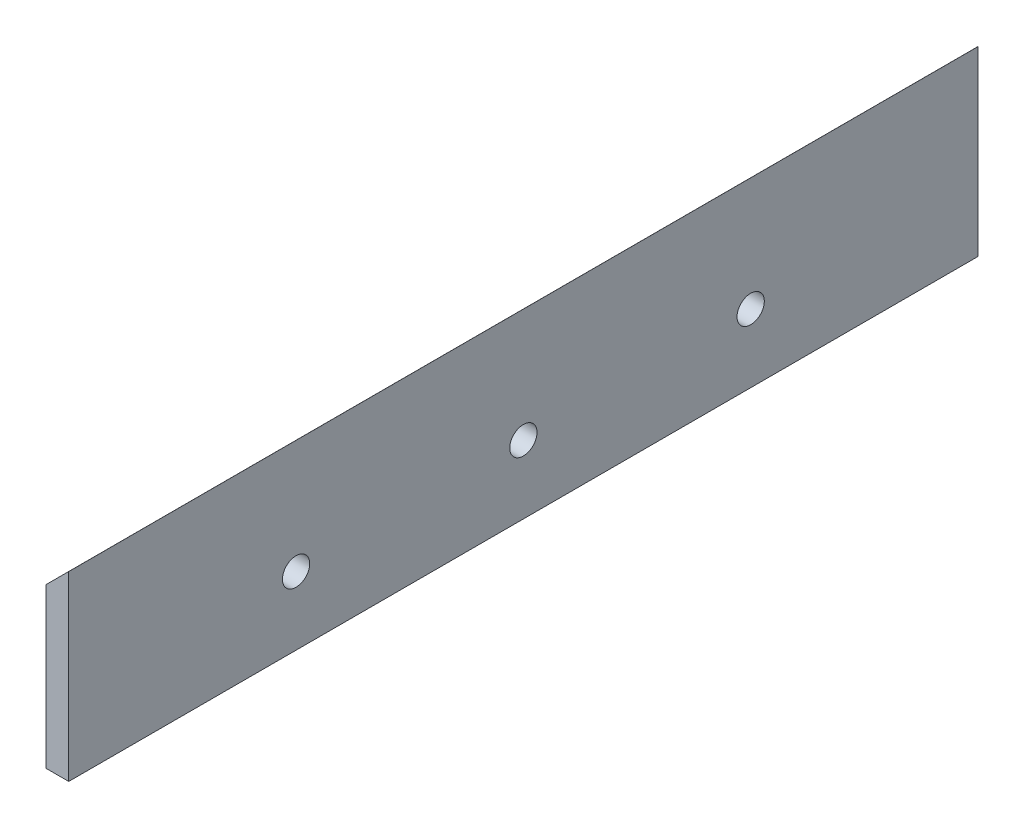
from build123d import *

# Parameters (mm, degrees)
EXTRUDE_1_DEPTH    = 200
CHAMFER1_SIZE      = 5
CHAMFER1_SIZE2     = 4.986026333
SKETCH1_R          = 3
CUT_EXTRUDE1_DEPTH = 5
LPATTERN1_COUNT    = 3
LPATTERN1_PITCH    = 50


with BuildPart() as part:
    # 草圖1 → 填料-伸長1 (new body)
    with BuildSketch(Plane.XY):
        Polygon((203.623972775, 1001.176903993), (198.623972775, 1001.176903993), (198.623972775, 1041.176903993), (203.623972775, 1041.162871417), align=None)
    extrude(amount=EXTRUDE_1_DEPTH)

    # Chamfer1
    chamfer1_edges = [part.edges().sort_by_distance(p)[0] for p in [
        (198.623972775, 1041.176903993, 100),
    ]]
    chamfer1_side = [part.faces().sort_by_distance(p)[0] for p in [
        (198.623972775, 1021.176903993, 100),
    ]]
    chamfer(chamfer1_edges, length=CHAMFER1_SIZE, length2=CHAMFER1_SIZE2, reference=chamfer1_side[0])

    # Sketch1 → Cut-Extrude1 (cut)
    with BuildSketch(Plane(origin=(203.623972775, 0, 0), x_dir=(0, 0, -1), z_dir=(1, 0, 0))):
        with Locations((-50, 1016.176903993)):
            Circle(SKETCH1_R)
    cut_extrude1 = extrude(amount=-CUT_EXTRUDE1_DEPTH, mode=Mode.SUBTRACT)

    # LPattern1: Cut-Extrude1 ×3
    with Locations(*[(0, 0, i * LPATTERN1_PITCH) for i in range(1, LPATTERN1_COUNT)]):
        add(cut_extrude1, mode=Mode.SUBTRACT)


solid = part.part
